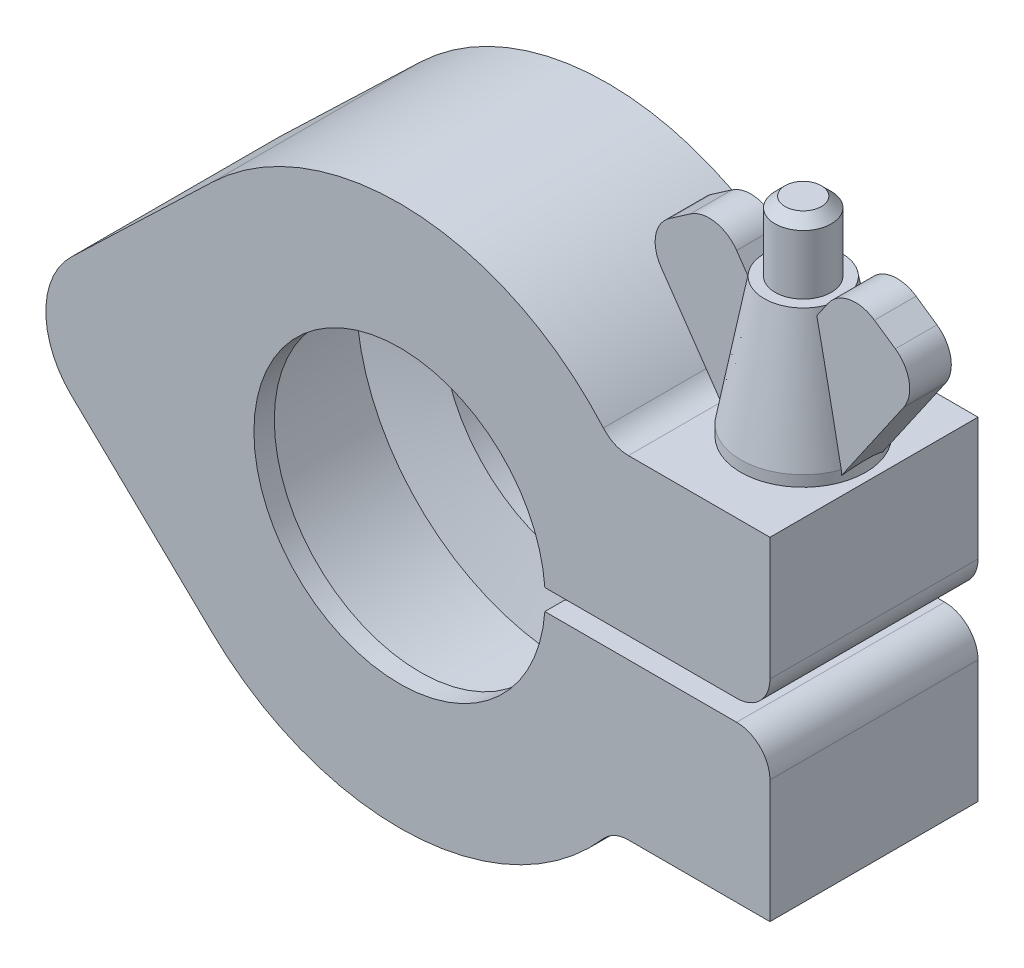
from build123d import *

# Parameters (mm, degrees)
BOSS_EXTRUDE1_DEPTH = 7.9375
BOSS_EXTRUDE2_DEPTH = 1.5875


with BuildPart() as part:
    # Sketch1 → Boss-Extrude1 (new, symmetric)
    with BuildSketch(Plane.XY):
        with BuildLine():
            Line((28.2575, -12.7), (28.2575, -3.33375))
            ThreePointArc((28.2575, -3.33375), (27.513551224, -1.537698776), (25.7175, -0.79375))
            Line((25.7175, -0.79375), (6.594808295, -0.79375))
            Line((6.594808295, -0.79375), (6.594808295, 0.79375))
            Line((6.594808295, 0.79375), (25.7175, 0.79375))
            ThreePointArc((25.7175, 0.79375), (27.513551224, 1.537698776), (28.2575, 3.33375))
            Line((28.2575, 3.33375), (28.2575, 12.7))
            Line((28.2575, 12.7), (17.4625, 12.7))
            ThreePointArc((17.4625, 12.7), (16.411440521, 12.927669147), (15.54880137, 13.569863014))
            ThreePointArc((15.54880137, 13.569863014), (0.91366194, 20.617265292), (-14.2875, 14.892070037))
            Line((-14.2875, 14.892070037), (-25.033653846, 4.582175396))
            ThreePointArc((-25.033653846, 4.582175396), (-26.9875, 0), (-25.033653846, -4.582175396))
            Line((-25.033653846, -4.582175396), (-14.2875, -14.892070037))
            ThreePointArc((-14.2875, -14.892070037), (0.91366194, -20.617265292), (15.54880137, -13.569863014))
            ThreePointArc((15.54880137, -13.569863014), (16.411440521, -12.927669147), (17.4625, -12.7))
            Line((17.4625, -12.7), (28.2575, -12.7))
        make_face()
    extrude(amount=BOSS_EXTRUDE1_DEPTH, both=True)

    # Sketch2 → Cut-Revolve1 (revolve, cut)
    with BuildSketch(Plane(origin=(0, 0, 0), x_dir=(0, 0, -1), z_dir=(1, 0, 0))):
        Polygon((5.0038, 16.256), (-5.0038, 16.256), (-6.381996671, 11.1125), (-17.041212854, 11.1125), (-17.041212854, 0), (17.041212854, 0), (17.041212854, 11.1125), (6.381996671, 11.1125), align=None)
    revolve(axis=Axis((0, 0, -17.041212854), (0, 0, -1)), mode=Mode.SUBTRACT)

    # Sketch3 → Revolve1 (revolve)
    with BuildSketch(Plane.XY):
        Polygon((22.86, 12.7), (27.6225, 12.7), (27.6225, 13.530402551), (25.834540931, 23.283333333), (25.00413838, 23.283333333), (25.00413838, 27.813), (24.24213838, 28.575), (22.86, 28.575), (22.86, 23.283333333), (22.86, 17.991666667), align=None)
    revolve(axis=Axis((22.86, 28.575, 0), (0, 1, 0)))

    # Sketch4 → Boss-Extrude2 (add, symmetric)
    with BuildSketch(Plane.XY):
        with BuildLine():
            Line((25.261436698, 22.452930783), (26.351802053, 24.0328217))
            ThreePointArc((26.351802053, 24.0328217), (27.98426331, 25.088440013), (29.885022603, 24.680550456))
            Line((29.885022603, 24.680550456), (31.474518222, 23.583556394))
            ThreePointArc((31.474518222, 23.583556394), (32.530136536, 21.951095136), (32.122246979, 20.050335843))
            Line((32.122246979, 20.050335843), (27.049395767, 12.7))
            Line((27.049395767, 12.7), (25.261436698, 22.452930783))
        make_face()
        with BuildLine():
            Line((20.458563302, 22.452930783), (18.670604233, 12.7))
            Line((18.670604233, 12.7), (13.597753021, 20.050335843))
            ThreePointArc((13.597753021, 20.050335843), (13.189863464, 21.951095136), (14.245481778, 23.583556394))
            Line((14.245481778, 23.583556394), (15.834977397, 24.680550456))
            ThreePointArc((15.834977397, 24.680550456), (17.73573669, 25.088440013), (19.368197947, 24.0328217))
            Line((19.368197947, 24.0328217), (20.458563302, 22.452930783))
        make_face()
    extrude(amount=BOSS_EXTRUDE2_DEPTH, both=True)


solid = part.part
